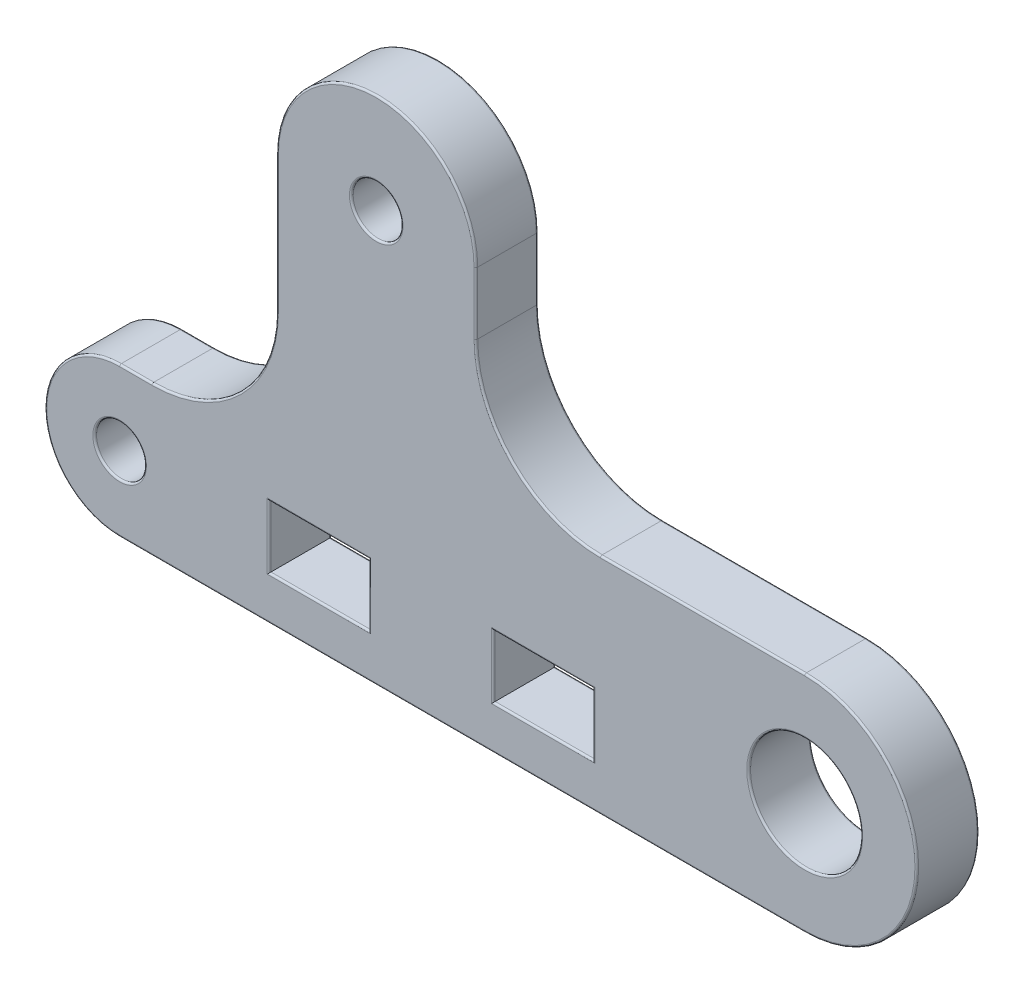
from build123d import *

# Parameters (mm, degrees)
SKETCH1_R           = 4.5
SKETCH1_R_2         = 2
SKETCH1_W           = 8
SKETCH1_H           = 5
BOSS_EXTRUDE1_DEPTH = 2.5
FILLET1_R           = 0.15


with BuildPart() as part:
    # Sketch1 → Boss-Extrude1 (new, symmetric)
    with BuildSketch(Plane.XY):
        with BuildLine():
            Line((-27.5, 0), (27.5, 0))
            ThreePointArc((27.5, 0), (36.5, 9), (27.5, 18))
            Line((27.5, 18), (11.1, 18))
            ThreePointArc((11.1, 18), (4.028932188, 20.928932188), (1.1, 28))
            Line((1.1, 28), (1.1, 33))
            ThreePointArc((1.1, 33), (-6.9, 41), (-14.9, 33))
            Line((-14.9, 33), (-14.9, 22))
            ThreePointArc((-14.9, 22), (-17.828932188, 14.928932188), (-24.9, 12))
            Line((-24.9, 12), (-27.5, 12))
            ThreePointArc((-27.5, 12), (-33.5, 6), (-27.5, 0))
        make_face()
        with Locations((27.5, 9)):
            Circle(SKETCH1_R, mode=Mode.SUBTRACT)
        with Locations((-27.5, 6)):
            Circle(SKETCH1_R_2, mode=Mode.SUBTRACT)
        with Locations((-6.9, 33)):
            Circle(SKETCH1_R_2, mode=Mode.SUBTRACT)
        with Locations((-11.5, 6)):
            Rectangle(SKETCH1_W, SKETCH1_H, mode=Mode.SUBTRACT)
        with Locations((6.5, 6)):
            Rectangle(SKETCH1_W, SKETCH1_H, mode=Mode.SUBTRACT)
    extrude(amount=BOSS_EXTRUDE1_DEPTH, both=True)

    # Fillet1
    fillet1_edges = [part.edges().sort_by_distance(p)[0] for p in [
        (36.5, 9, 2.5),
        (-14.9, 27.5, -2.5),
        (-6.9, 41, -2.5),
        (1.1, 30.5, -2.5),
        (4.028932188, 20.928932188, -2.5),
        (19.3, 18, -2.5),
        (36.5, 9, -2.5),
        (0, 0, -2.5),
        (-33.5, 6, -2.5),
        (19.3, 18, 2.5),
        (4.028932188, 20.928932188, 2.5),
        (1.1, 30.5, 2.5),
        (-6.9, 41, 2.5),
        (-14.9, 27.5, 2.5),
        (23, 9, -2.5),
        (23, 9, 2.5),
        (-17.828932188, 14.928932188, 2.5),
        (-29.5, 6, -2.5),
        (-29.5, 6, 2.5),
        (-26.2, 12, 2.5),
        (-8.9, 33, -2.5),
        (-8.9, 33, 2.5),
        (-15.5, 6, -2.5),
        (-11.5, 3.5, -2.5),
        (-33.5, 6, 2.5),
        (-7.5, 6, -2.5),
        (-11.5, 8.5, -2.5),
        (-15.5, 6, 2.5),
        (-11.5, 3.5, 2.5),
        (-7.5, 6, 2.5),
        (-11.5, 8.5, 2.5),
        (2.5, 6, -2.5),
        (6.5, 3.5, -2.5),
        (10.5, 6, -2.5),
        (6.5, 8.5, -2.5),
        (2.5, 6, 2.5),
        (6.5, 3.5, 2.5),
        (10.5, 6, 2.5),
        (6.5, 8.5, 2.5),
        (0, 0, 2.5),
        (-26.2, 12, -2.5),
        (-17.828932188, 14.928932188, -2.5),
    ]]
    fillet(fillet1_edges, radius=FILLET1_R)


solid = part.part
